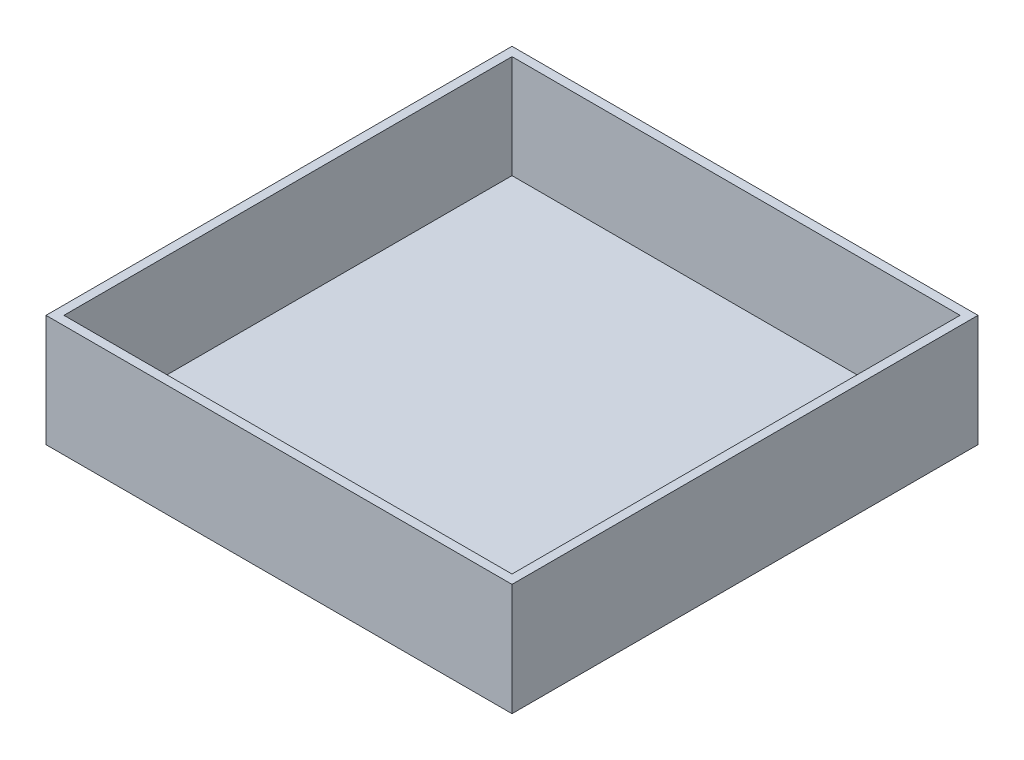
from build123d import *

# Parameters (mm, degrees)
SKETCH1_W           = 520
SKETCH1_H           = 520
BOSS_EXTRUDE1_DEPTH = 125
SHELL1_T            = -10


with BuildPart() as part:
    # Sketch1 → Boss-Extrude1 (new body)
    with BuildSketch(Plane(origin=(0, 0, 0), x_dir=(1, 0, 0), z_dir=(0, 1, 0))):
        Rectangle(SKETCH1_W, SKETCH1_H)
    extrude(amount=BOSS_EXTRUDE1_DEPTH)

    # Shell1
    shell1_openings = [part.faces().sort_by_distance(p)[0] for p in [
        (0, 125, 0),
    ]]
    offset(amount=SHELL1_T, openings=shell1_openings, kind=Kind.INTERSECTION)


solid = part.part
